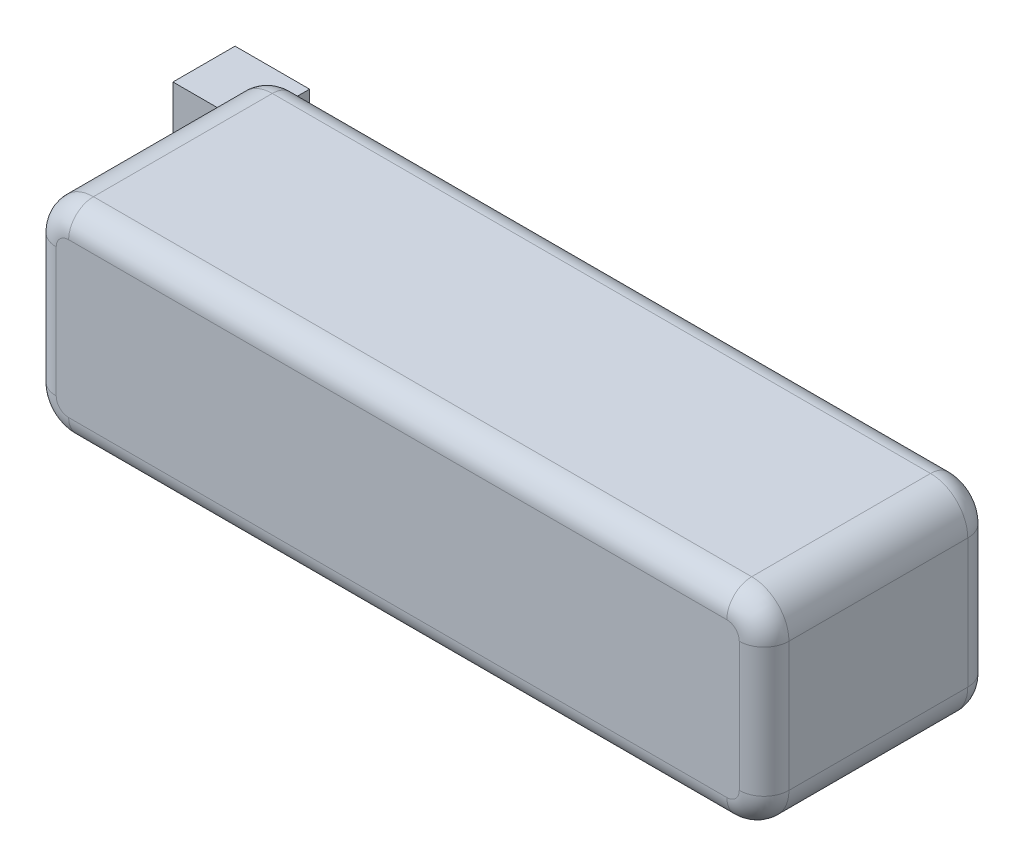
from build123d import *

# Parameters (mm, degrees)
SKETCH1_W           = 74.93
SKETCH1_H           = 23.368
BOSS_EXTRUDE1_DEPTH = 20.828
SKETCH2_W           = 5.08
SKETCH2_H           = 10.16
SKETCH2_W_2         = 1.27
BOSS_EXTRUDE2_DEPTH = 7.62
FILLET1_R           = 2.54
FILLET2_R           = 3.81
FILLET3_R           = 2.54
FILLET4_R           = 2.54


with BuildPart() as part:
    # Sketch1 → Boss-Extrude1 (new body)
    with BuildSketch(Plane(origin=(0, 0, 0), x_dir=(1, 0, 0), z_dir=(0, 1, 0))):
        with Locations((37.465, -11.684)):
            Rectangle(SKETCH1_W, SKETCH1_H)
    extrude(amount=BOSS_EXTRUDE1_DEPTH)

    # Sketch2 → Boss-Extrude2 (add)
    with BuildSketch(Plane.ZY):
        with Locations((-2.54, 10.414)):
            Rectangle(SKETCH2_W, SKETCH2_H)
        with Locations((0.635, 10.414)):
            Rectangle(SKETCH2_W_2, SKETCH2_H)
    extrude(amount=BOSS_EXTRUDE2_DEPTH)

    # Fillet1
    fillet1_edges = [part.edges().sort_by_distance(p)[0] for p in [
        (0, 10.414, 0),
        (0, 10.414, 1.27),
    ]]
    fillet(fillet1_edges, radius=FILLET1_R)

    # Fillet2
    fillet2_edges = [part.edges().sort_by_distance(p)[0] for p in [
        (74.93, 20.828, 11.684),
        (0, 20.828, 11.684),
        (74.93, 0, 11.684),
        (0, 0, 11.684),
    ]]
    fillet(fillet2_edges, radius=FILLET2_R)

    # Fillet3
    fillet3_edges = [part.edges().sort_by_distance(p)[0] for p in [
        (37.465, 20.828, 23.368),
        (37.465, 0, 23.368),
        (74.93, 10.414, 23.368),
        (0, 10.414, 23.368),
        (1.115923164, 1.115923164, 23.368),
        (73.814076836, 1.115923164, 23.368),
        (73.814076836, 19.712076836, 23.368),
        (1.115923164, 19.712076836, 23.368),
    ]]
    fillet(fillet3_edges, radius=FILLET3_R)

    # Fillet4
    fillet4_edges = [part.edges().sort_by_distance(p)[0] for p in [
        (0, 16.256, 0),
        (1.115923164, 19.712076836, 0),
        (37.465, 20.828, 0),
        (73.814076836, 19.712076836, 0),
        (74.93, 10.414, 0),
        (73.814076836, 1.115923164, 0),
        (0, 4.572, 0),
        (1.115923164, 1.115923164, 0),
        (37.465, 0, 0),
    ]]
    fillet(fillet4_edges, radius=FILLET4_R)


solid = part.part
